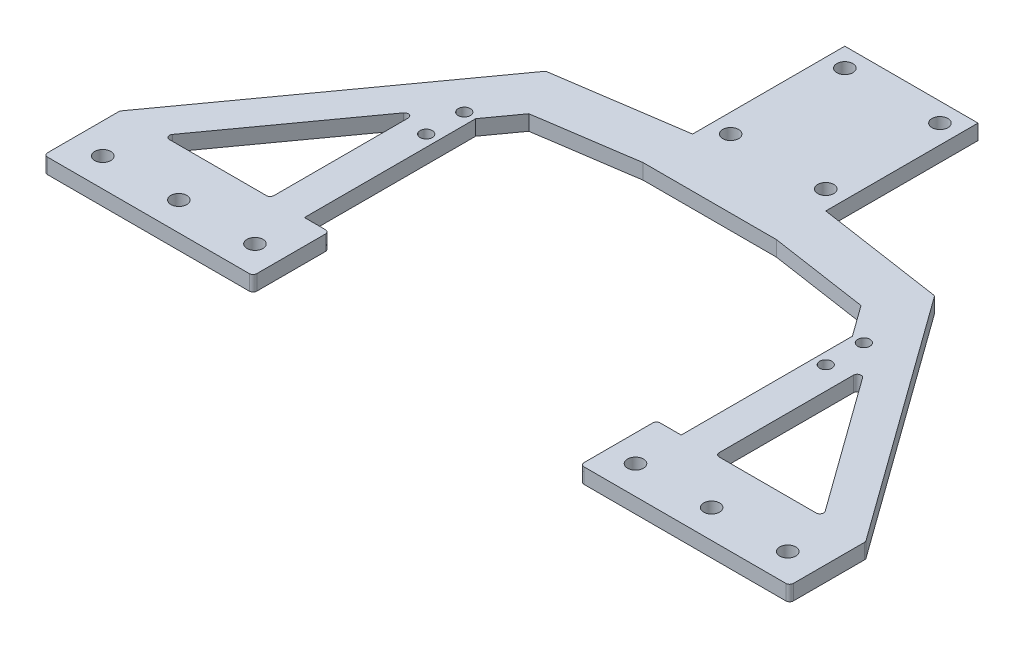
from build123d import *

# Parameters (mm, degrees)
SKETCH_1_R          = 2.1
EXTRUDE_1_DEPTH     = 4
SKETCH_2_R          = 1.6
SKETCH_2_R_2        = 2.1
EXTRUDE_2_DEPTH     = 4
CUT_EXTRUDE_1_DEPTH = 174.943237868
FILLET_2_R          = 1
FILLET_3_R          = 1


with BuildPart() as part:
    # 草图1 → 凸台-拉伸1 (new body)
    with BuildSketch(Plane(origin=(0, 0, 0), x_dir=(1, 0, 0), z_dir=(0, 1, 0))):
        Polygon((0, 0), (0, -110), (-62.5, -110), (-62.5, -130), (97.5, -130), (97.5, -110), (35, -110), (35, 0), align=None)
        with Locations(Location((5, -5, 0), (0, 0, 270))):
            Circle(SKETCH_1_R, mode=Mode.SUBTRACT)
        with Locations(Location((30, -5, 0), (0, 0, 270))):
            Circle(SKETCH_1_R, mode=Mode.SUBTRACT)
        with Locations(Location((5, -35, 0), (0, 0, 270))):
            Circle(SKETCH_1_R, mode=Mode.SUBTRACT)
        with Locations(Location((30, -35, 0), (0, 0, 270))):
            Circle(SKETCH_1_R, mode=Mode.SUBTRACT)
        with Locations(Location((-52.5, -122.5, 0), (0, 0, 270))):
            Circle(SKETCH_1_R, mode=Mode.SUBTRACT)
        with Locations(Location((-32.5, -122.5, 0), (0, 0, 270))):
            Circle(SKETCH_1_R, mode=Mode.SUBTRACT)
        with Locations(Location((-12.5, -122.5, 0), (0, 0, 270))):
            Circle(SKETCH_1_R, mode=Mode.SUBTRACT)
        with Locations(Location((7.5, -122.5, 0), (0, 0, 270))):
            Circle(SKETCH_1_R, mode=Mode.SUBTRACT)
        with Locations(Location((27.5, -122.5, 0), (0, 0, 270))):
            Circle(SKETCH_1_R, mode=Mode.SUBTRACT)
        with Locations(Location((47.5, -122.5, 0), (0, 0, 270))):
            Circle(SKETCH_1_R, mode=Mode.SUBTRACT)
        with Locations(Location((67.5, -122.5, 0), (0, 0, 270))):
            Circle(SKETCH_1_R, mode=Mode.SUBTRACT)
        with Locations(Location((87.5, -122.5, 0), (0, 0, 270))):
            Circle(SKETCH_1_R, mode=Mode.SUBTRACT)
    extrude(amount=EXTRUDE_1_DEPTH)

    # 草图2 → 凸台-拉伸2 (add)
    # profile 1 of 2: a face of its own
    with BuildSketch(Plane(origin=(0, 4, 0), x_dir=(1, 0, 0), z_dir=(0, 1, 0))):
        Polygon((0, -40), (0, -53), (-26.149225941, -56.891259047), (-32, -65), (-32, -110), (-41, -110), (-41, -70.637206461), (-69.401796613, -110), (-62.5, -110), (-62.5, -130), (-80.5, -130), (-80.5, -110), (-33.599955214, -45), align=None)
        with Locations(Location((-35, -65, 0), (0, 0, 270))):
            Circle(SKETCH_2_R, mode=Mode.SUBTRACT)
        with Locations(Location((-35, -75, 0), (0, 0, 270))):
            Circle(SKETCH_2_R, mode=Mode.SUBTRACT)
        with Locations(Location((-72.5, -122.5, 0), (0, 0, 270))):
            Circle(SKETCH_2_R_2, mode=Mode.SUBTRACT)
    # profile 2 of 2: a face of its own
    with BuildSketch(Plane(origin=(0, 4, 0), x_dir=(1, 0, 0), z_dir=(0, 1, 0))):
        Polygon((67, -65), (67, -110), (76, -110), (76, -70.637206461), (104.401796613, -110), (97.5, -110), (97.5, -130), (115.5, -130), (115.5, -110), (68.599955214, -45), (35, -40), (35, -53), (61.149225941, -56.891259047), align=None)
        with Locations(Location((70, -65, 0), (0, 0, 270))):
            Circle(SKETCH_2_R, mode=Mode.SUBTRACT)
        with Locations(Location((70, -75, 0), (0, 0, 270))):
            Circle(SKETCH_2_R, mode=Mode.SUBTRACT)
        with Locations(Location((107.5, -122.5, 0), (0, 0, 270))):
            Circle(SKETCH_2_R_2, mode=Mode.SUBTRACT)
    extrude(amount=-EXTRUDE_2_DEPTH)

    # 草图3 → 切除-拉伸1 (cut, through all)
    with BuildSketch(Plane(origin=(0, 4, 0), x_dir=(1, 0, 0), z_dir=(0, 1, 0))):
        Polygon((0, -53), (35, -53), (35, -110), (60.5, -110), (60.5, -130), (-25.5, -130), (-25.5, -110), (0, -110), align=None)
    extrude(amount=-CUT_EXTRUDE_1_DEPTH, mode=Mode.SUBTRACT)

    # 圆角2
    fillet_2_edges = [part.edges().sort_by_distance(p)[0] for p in [
        (76, 2, 70.637206461),
        (104.401796613, 2, 110),
        (76, 2, 110),
        (-41, 2, 70.637206461),
        (-41, 2, 110),
        (-69.401796613, 2, 110),
    ]]
    fillet(fillet_2_edges, radius=FILLET_2_R)

    # 圆角3
    fillet_3_edges = [part.edges().sort_by_distance(p)[0] for p in [
        (115.5, 2, 130),
        (115.5, 2, 110),
        (68.599955214, 2, 45),
        (60.5, 2, 110),
        (60.5, 2, 130),
        (-25.5, 2, 130),
        (-25.5, 2, 110),
        (-33.599955214, 2, 45),
        (-80.5, 2, 110),
        (-80.5, 2, 130),
    ]]
    fillet(fillet_3_edges, radius=FILLET_3_R)


solid = part.part
